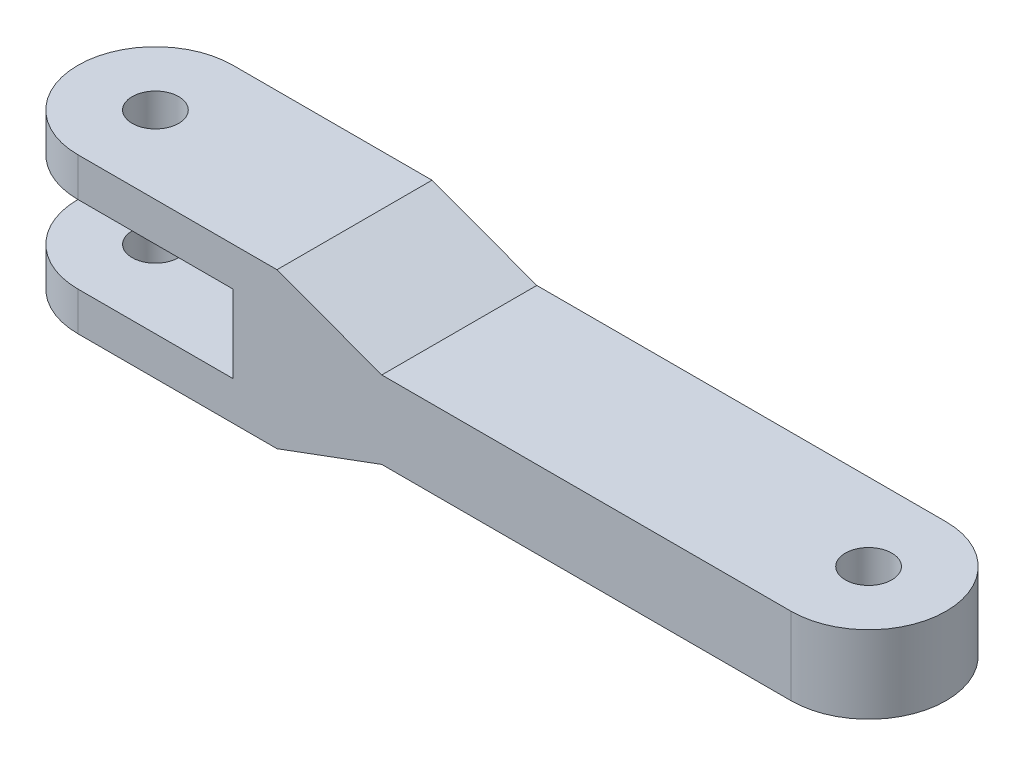
from build123d import *

# Parameters (mm, degrees)
SALIENTE_EXTRUIR1_DEPTH = 10
CROQUIS2_R              = 1.5
CORTAR_EXTRUIR1_DEPTH   = 10
CROQUIS3_W              = 15
CROQUIS3_H              = 2.5
CORTAR_EXTRUIR2_DEPTH   = 10
CROQUIS4_R              = 1.5
CORTAR_EXTRUIR3_DEPTH   = 10
CORTAR_EXTRUIR5_DEPTH   = 10
CROQUIS9_R              = 1.5
SALIENTE_EXTRUIR2_DEPTH = 2.5
CROQUIS11_R             = 1.5
CORTAR_EXTRUIR8_DEPTH   = 10
CORTAR_EXTRUIR9_DEPTH   = 58.758116313


with BuildPart() as part:
    # Croquis1 → Saliente-Extruir1 (new body)
    with BuildSketch(Plane.XY):
        Polygon((0, 0), (39.6, 0), (39.6, 2.5), (39.6, 7.5), (39.6, 10), (0, 10), (0, 7.5), (15, 7.5), (15, 2.5), (0, 2.5), align=None)
    extrude(amount=SALIENTE_EXTRUIR1_DEPTH)

    # Croquis2 → Cortar-Extruir1 (cut)
    with BuildSketch(Plane(origin=(0, 10, 0), x_dir=(1, 0, 0), z_dir=(0, 1, 0))):
        with Locations(Location((5, -5, 0), (0, 0, 270))):
            Circle(CROQUIS2_R)
        with BuildLine():
            Line((-4.031911586, 0), (5, 0))
            ThreePointArc((5, 0), (0, -5), (5, -10))
            Line((5, -10), (-4.031911586, -10))
            Line((-4.031911586, -10), (-4.031911586, 0))
        make_face()
    extrude(amount=-CORTAR_EXTRUIR1_DEPTH, mode=Mode.SUBTRACT)

    # Croquis3 → Cortar-Extruir2 (cut)
    with BuildSketch(Plane(origin=(0, 10, 0), x_dir=(1, 0, 0), z_dir=(0, 1, 0))):
        with Locations((32.1, -1.25)):
            Rectangle(CROQUIS3_W, CROQUIS3_H)
        with Locations((32.1, -8.75)):
            Rectangle(CROQUIS3_W, CROQUIS3_H)
    extrude(amount=-CORTAR_EXTRUIR2_DEPTH, mode=Mode.SUBTRACT)

    # Croquis4 → Cortar-Extruir3 (cut)
    with BuildSketch(Plane.XY.offset(7.5)):
        with Locations((34.6, 5)):
            Circle(CROQUIS4_R)
        with BuildLine():
            Line((34.6, 10), (103.004091933, 10))
            Line((103.004091933, 10), (103.004091933, 0))
            Line((103.004091933, 0), (34.6, 0))
            ThreePointArc((34.6, 0), (39.6, 5), (34.6, 10))
        make_face()
    extrude(amount=-CORTAR_EXTRUIR3_DEPTH, mode=Mode.SUBTRACT)

    # Croquis8 → Cortar-Extruir5 (cut)
    with BuildSketch(Plane.XY.offset(7.5)):
        with BuildLine():
            Line((24.6, 0), (34.6, 0))
            ThreePointArc((34.6, 0), (39.6, 5), (34.6, 10))
            Line((34.6, 10), (24.6, 10))
            Line((24.6, 10), (24.6, 0))
        make_face()
    extrude(amount=-CORTAR_EXTRUIR5_DEPTH, mode=Mode.SUBTRACT)

    # Croquis9 → Saliente-Extruir2 (add, symmetric)
    with BuildSketch(Plane(origin=(0, 5, 0), x_dir=(-1, 0, 0), z_dir=(0, -1, 0))):
        with BuildLine():
            Line((-24.6, -10), (-95, -10))
            ThreePointArc((-95, -10), (-100, -5), (-95, 0))
            Line((-95, 0), (-24.6, 0))
            Line((-24.6, 0), (-24.6, -10))
        make_face()
        with Locations(Location((-95, -5, 0), (0, 0, 90))):
            Circle(CROQUIS9_R, mode=Mode.SUBTRACT)
    extrude(amount=SALIENTE_EXTRUIR2_DEPTH, both=True)

    # Croquis11 → Cortar-Extruir8 (cut)
    with BuildSketch(Plane.XZ.offset(-2.5)):
        with Locations(Location((51, 5, 0), (0, 0, 270))):
            Circle(CROQUIS11_R)
        with BuildLine():
            Line((51, 10), (51, 16.019823118))
            Line((51, 16.019823118), (124.451684226, 16.019823118))
            Line((124.451684226, 16.019823118), (123.024656772, -12.837843177))
            Line((123.024656772, -12.837843177), (54.838697363, -9.466010019))
            Line((54.838697363, -9.466010019), (51, 0))
            ThreePointArc((51, 0), (56, 5), (51, 10))
        make_face()
    extrude(amount=-CORTAR_EXTRUIR8_DEPTH, mode=Mode.SUBTRACT)

    # Croquis12 → Cortar-Extruir9 (cut, through all)
    with BuildSketch(Plane.XY.offset(10)):
        Polygon((24.6, 7.5), (17.841989968, 10), (24.6, 10), align=None)
        Polygon((24.6, 2.5), (17.841989968, 0), (24.6, 0), align=None)
    extrude(amount=-CORTAR_EXTRUIR9_DEPTH, mode=Mode.SUBTRACT)


solid = part.part
